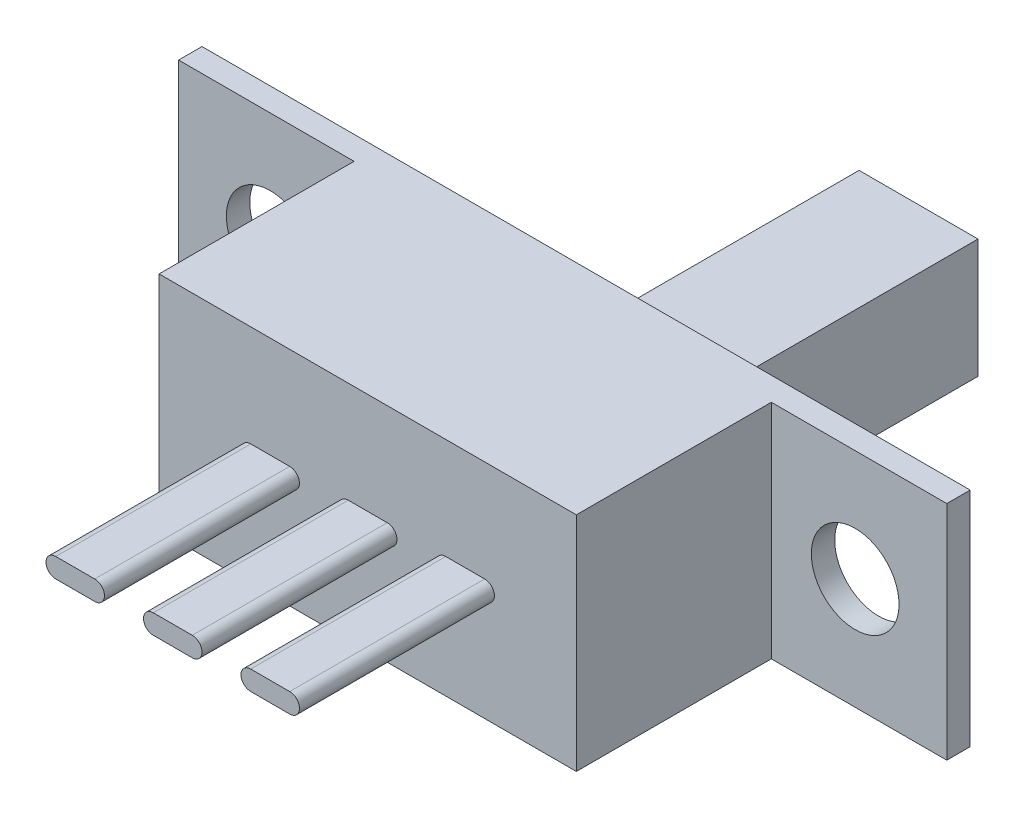
from build123d import *

# Parameters (mm, degrees)
SKETCH1_W           = 19.7
SKETCH1_H           = 5.7
SKETCH1_R           = 1.125
BOSS_EXTRUDE1_DEPTH = 0.6
SKETCH2_W           = 10.7
SKETCH2_H           = 5.7
BOSS_EXTRUDE2_DEPTH = 5
SKETCH3_W           = 3.05
SKETCH3_H           = 3.05
BOSS_EXTRUDE3_DEPTH = 7
BOSS_EXTRUDE4_DEPTH = 5


with BuildPart() as part:
    # Sketch1 → Boss-Extrude1 (new body)
    with BuildSketch(Plane.XY):
        with Locations((0, -89.5)):
            Rectangle(SKETCH1_W, SKETCH1_H)
        with Locations((7.5, -89.5)):
            Circle(SKETCH1_R, mode=Mode.SUBTRACT)
        with Locations((-7.5, -89.5)):
            Circle(SKETCH1_R, mode=Mode.SUBTRACT)
    extrude(amount=BOSS_EXTRUDE1_DEPTH)

    # Sketch2 → Boss-Extrude2 (add)
    with BuildSketch(Plane.XY.offset(0.6)):
        with Locations((0, -89.5)):
            Rectangle(SKETCH2_W, SKETCH2_H)
    extrude(amount=BOSS_EXTRUDE2_DEPTH)

    # Sketch3 → Boss-Extrude3 (add)
    with BuildSketch(Plane(origin=(0, 0, 0), x_dir=(-1, 0, 0), z_dir=(0, 0, -1))):
        with Locations((-1.525, -89.5)):
            Rectangle(SKETCH3_W, SKETCH3_H)
    extrude(amount=BOSS_EXTRUDE3_DEPTH)

    # Sketch4 → Boss-Extrude4 (add)
    with BuildSketch(Plane.XY.offset(5.6)):
        with BuildLine():
            Line((-0.5, -89.25), (0.5, -89.25))
            ThreePointArc((0.5, -89.25), (0.75, -89.5), (0.5, -89.75))
            Line((0.5, -89.75), (-0.5, -89.75))
            ThreePointArc((-0.5, -89.75), (-0.75, -89.5), (-0.5, -89.25))
        make_face()
        with BuildLine():
            Line((2, -89.25), (3, -89.25))
            ThreePointArc((3, -89.25), (3.25, -89.5), (3, -89.75))
            Line((3, -89.75), (2, -89.75))
            ThreePointArc((2, -89.75), (1.75, -89.5), (2, -89.25))
        make_face()
        with BuildLine():
            Line((-3, -89.25), (-2, -89.25))
            ThreePointArc((-2, -89.25), (-1.75, -89.5), (-2, -89.75))
            Line((-2, -89.75), (-3, -89.75))
            ThreePointArc((-3, -89.75), (-3.25, -89.5), (-3, -89.25))
        make_face()
    extrude(amount=BOSS_EXTRUDE4_DEPTH)


solid = part.part
